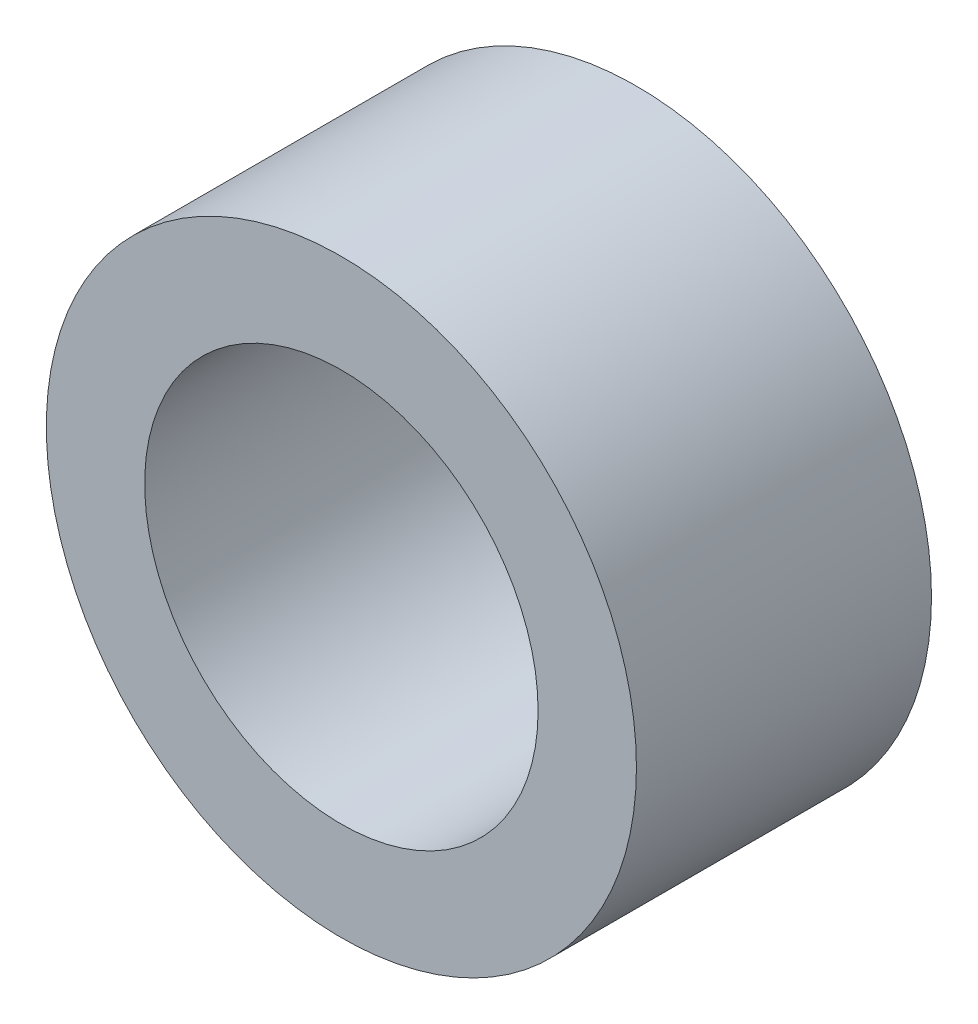
from build123d import *

# Parameters (mm, degrees)
BOSS_EXTRUDE1_START = 19.05
SKETCH1_R           = 38.1
SKETCH1_R_2         = 25.4
BOSS_EXTRUDE1_DEPTH = 38.1


with BuildPart() as part:
    # Sketch1 → Boss-Extrude1 (new body)
    with BuildSketch(Plane.XY.offset(BOSS_EXTRUDE1_START)):
        Circle(SKETCH1_R)
        Circle(SKETCH1_R_2, mode=Mode.SUBTRACT)
    extrude(amount=-BOSS_EXTRUDE1_DEPTH)


solid = part.part
